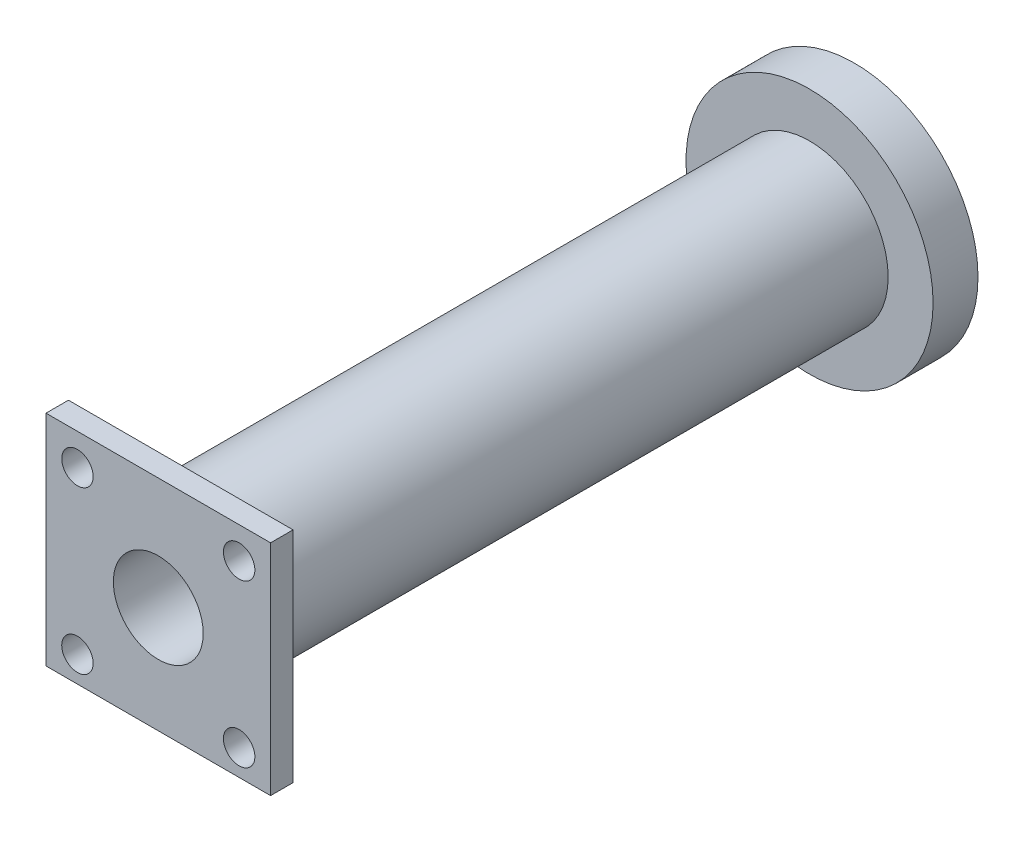
from build123d import *

# Parameters (mm, degrees)
SKETCH1_R           = 139.7
SKETCH1_R_2         = 88.9
BOSS_EXTRUDE3_DEPTH = 50.8
SKETCH1_4_R         = 88.9
SKETCH1_4_R_2       = 50.8
BOSS_EXTRUDE4_DEPTH = 762
SKETCH3_W           = 254
SKETCH3_H           = 247.65
SKETCH3_R           = 17.78
SKETCH3_R_2         = 50.8
BOSS_EXTRUDE5_DEPTH = 25.4


with BuildPart() as part:
    # Sketch1 → Boss-Extrude3 (new body)
    with BuildSketch(Plane.XY):
        Circle(SKETCH1_R)
        Circle(SKETCH1_R_2, mode=Mode.SUBTRACT)
    extrude(amount=BOSS_EXTRUDE3_DEPTH)

    # Sketch1<4> → Boss-Extrude4 (add)
    with BuildSketch(Plane.XY):
        Circle(SKETCH1_4_R)
        Circle(SKETCH1_4_R_2, mode=Mode.SUBTRACT)
    extrude(amount=BOSS_EXTRUDE4_DEPTH)

    # Sketch3 → Boss-Extrude5 (add)
    with BuildSketch(Plane.XY.offset(762)):
        with Locations((0, 3.175)):
            Rectangle(SKETCH3_W, SKETCH3_H)
        with Locations((-91.44, 91.44)):
            Circle(SKETCH3_R, mode=Mode.SUBTRACT)
        with Locations((91.44, 91.44)):
            Circle(SKETCH3_R, mode=Mode.SUBTRACT)
        with Locations((91.44, -91.44)):
            Circle(SKETCH3_R, mode=Mode.SUBTRACT)
        with Locations((-91.44, -91.44)):
            Circle(SKETCH3_R, mode=Mode.SUBTRACT)
        Circle(SKETCH3_R_2, mode=Mode.SUBTRACT)
    extrude(amount=BOSS_EXTRUDE5_DEPTH)


solid = part.part
